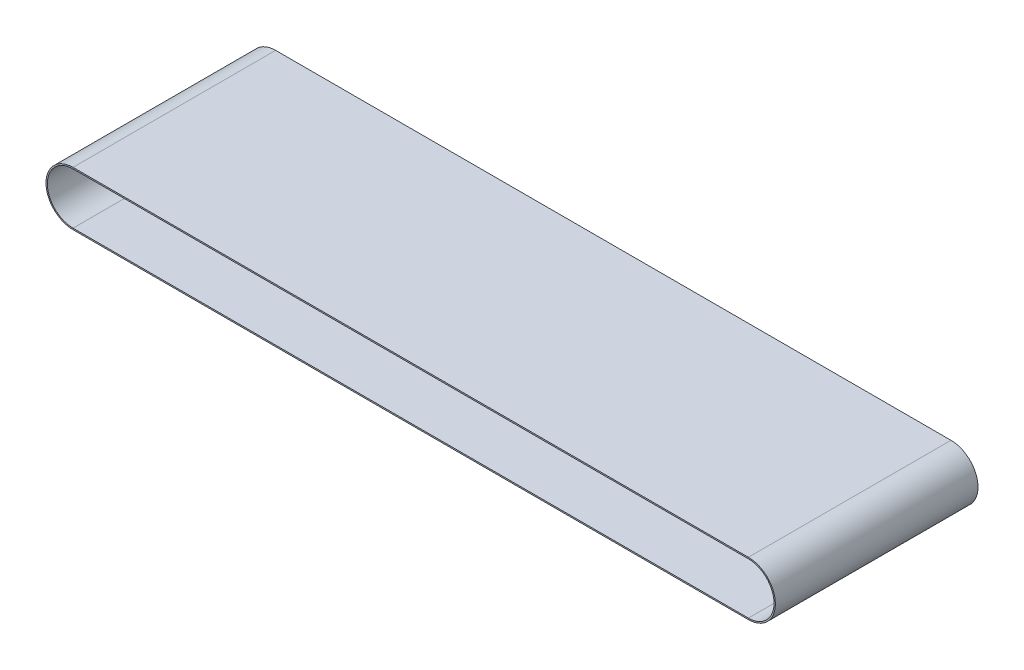
from build123d import *

# Parameters (mm, degrees)
EXTRUDE_1_DEPTH = 150


with BuildPart() as part:
    # 草图1 → 拉伸-薄壁1 (new, symmetric)
    with BuildSketch(Plane.XY):
        with BuildLine():
            Line((500, -40), (-500, -40))
            ThreePointArc((-500, -40), (-540, 0), (-500, 40))
            Line((-500, 40), (500, 40))
            ThreePointArc((500, 40), (540, 0), (500, -40))
        make_face()
        with BuildLine():
            Line((500, -38), (-500, -38))
            ThreePointArc((-500, -38), (-538, 0), (-500, 38))
            Line((-500, 38), (500, 38))
            ThreePointArc((500, 38), (538, 0), (500, -38))
        make_face(mode=Mode.SUBTRACT)
    extrude(amount=EXTRUDE_1_DEPTH, both=True)


solid = part.part
